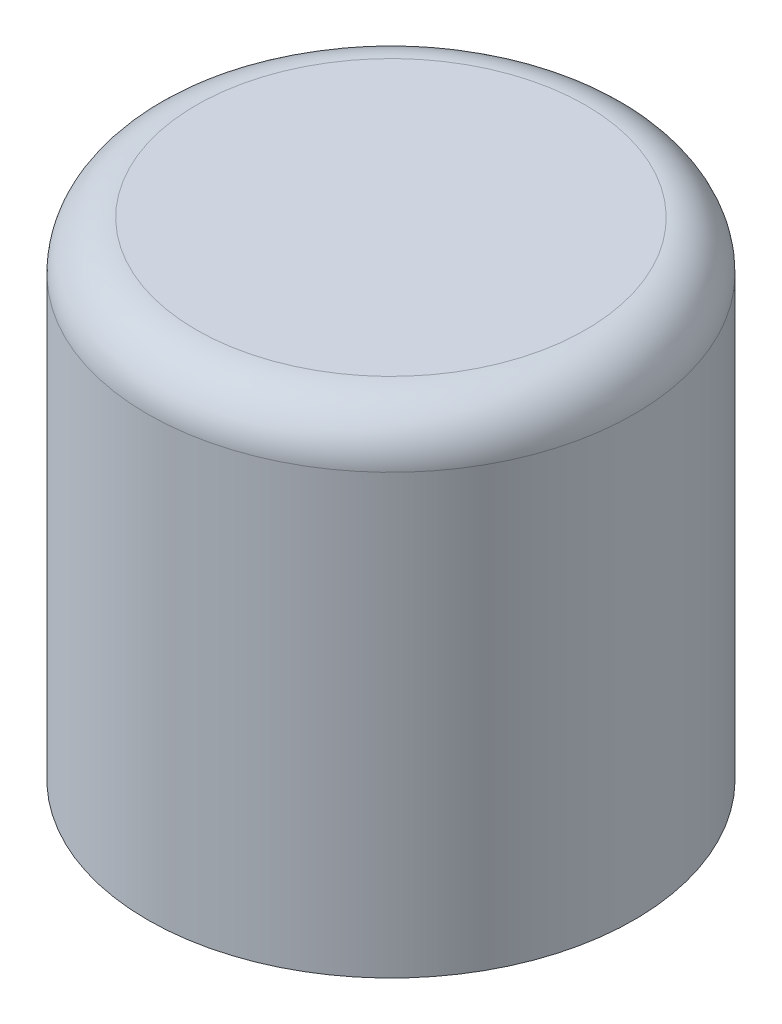
from build123d import *

# Parameters (mm, degrees)
SKETCH1_R           = 5
BOSS_EXTRUDE1_DEPTH = 10
FILLET1_R           = 1


with BuildPart() as part:
    # Sketch1 → Boss-Extrude1 (new body)
    with BuildSketch(Plane(origin=(0, 0, 0), x_dir=(1, 0, 0), z_dir=(0, 1, 0))):
        with Locations(Location((0, 0, 0), (0, 0, 270))):
            Circle(SKETCH1_R)
    extrude(amount=BOSS_EXTRUDE1_DEPTH)

    # Fillet1
    fillet1_edges = [part.edges().sort_by_distance(p)[0] for p in [
        (0, 10, -5),
    ]]
    fillet(fillet1_edges, radius=FILLET1_R)


solid = part.part
